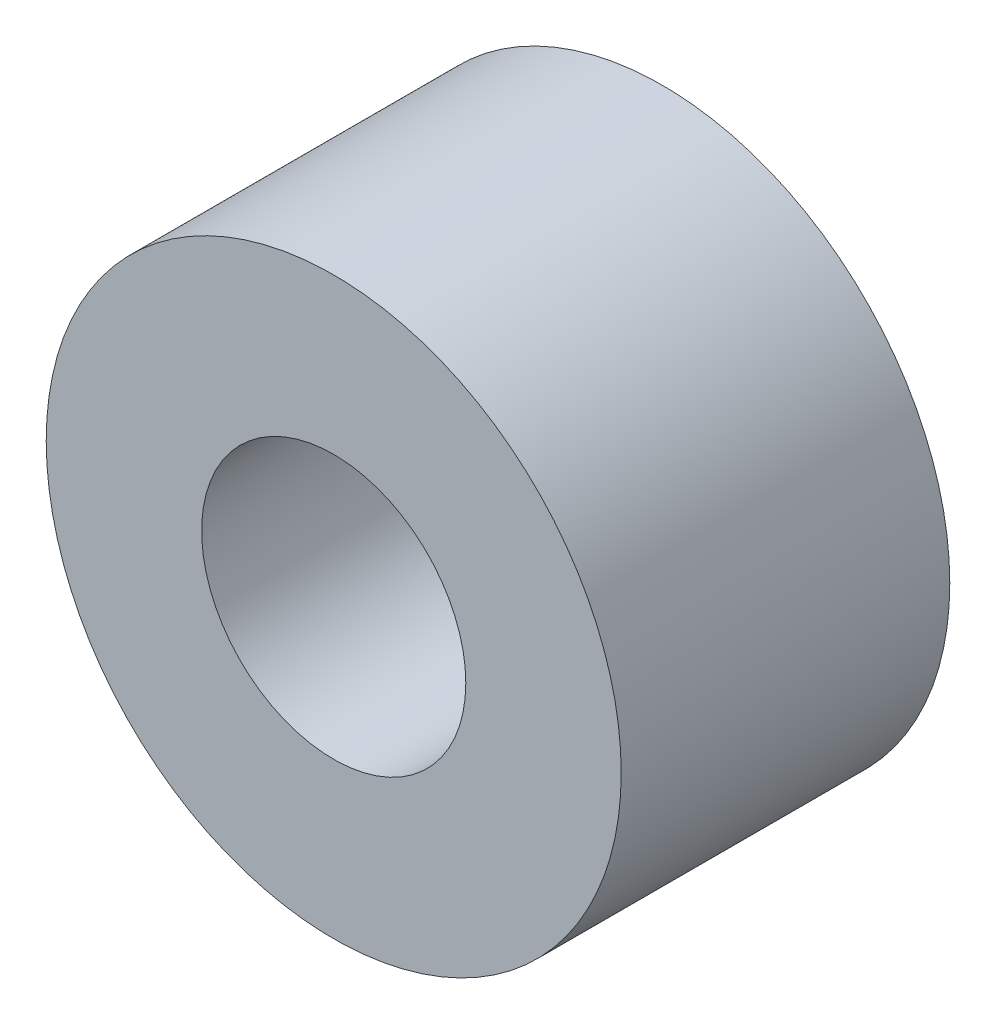
from build123d import *

# Parameters (mm, degrees)
SKETCH1_R           = 5.55625
SKETCH1_R_2         = 2.5527
BOSS_EXTRUDE1_DEPTH = 6.35


with BuildPart() as part:
    # Sketch1 → Boss-Extrude1 (new body)
    with BuildSketch(Plane.XY):
        Circle(SKETCH1_R)
        Circle(SKETCH1_R_2, mode=Mode.SUBTRACT)
    extrude(amount=BOSS_EXTRUDE1_DEPTH)


solid = part.part
